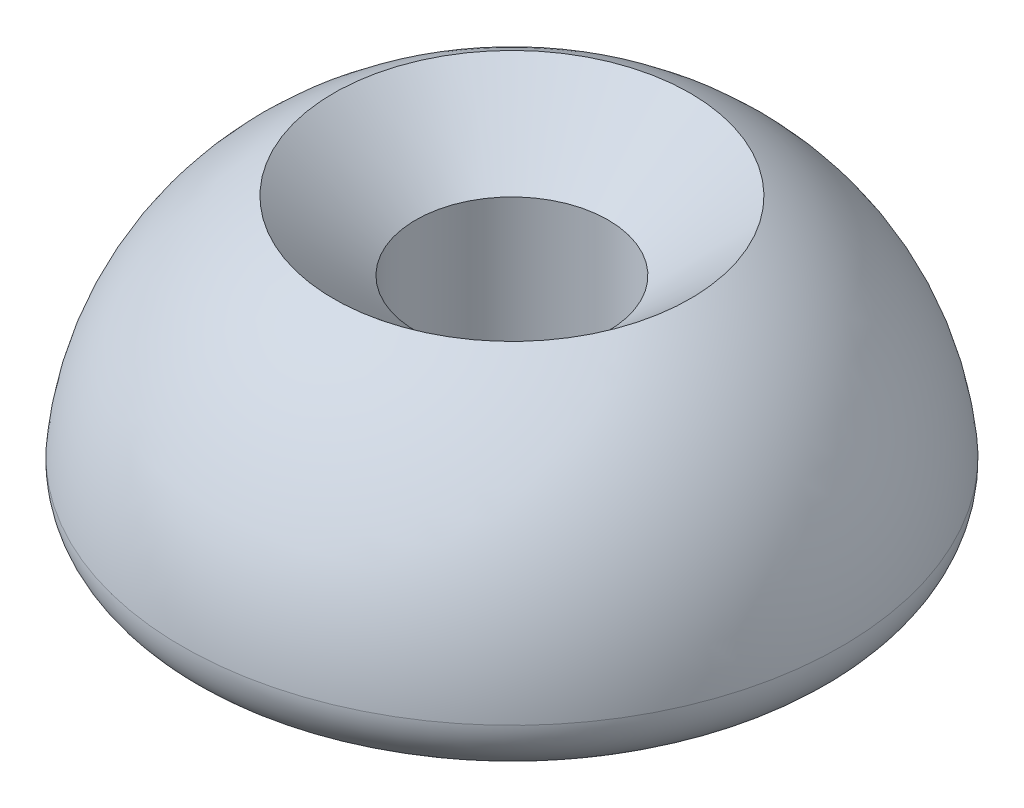
from build123d import *


with BuildPart() as part:
    # Esquisse1 → Révolution1 (revolve)
    with BuildSketch(Plane.XY, mode=Mode.PRIVATE) as r_volution1_sk:
        with BuildLine():
            Line((17, -27.03771478), (17, -54.716239606))
            Line((17, -54.716239606), (58.25, -54.716239606))
            ThreePointArc((58.25, -54.716239606), (49.968079003, -31.374298992), (31.5, -14.870770128))
            Line((31.5, -14.870770128), (17, -27.03771478))
        make_face()
        with BuildLine():
            Line((17, -54.716239606), (17, -64.870770128))
            Line((17, -64.870770128), (46.509488902, -64.870770128))
            Line((46.509488902, -64.870770128), (50, -64.870770128))
            ThreePointArc((50, -64.870770128), (56.016092449, -61.329913928), (58.25, -54.716239606))
            Line((58.25, -54.716239606), (17, -54.716239606))
        make_face()
    revolve(r_volution1_sk.sketch.rotate(Axis((0, -84.791176471, 0), (0, 1, 0)), 90), axis=Axis((0, -84.791176471, 0), (0, 1, 0)))


solid = part.part
